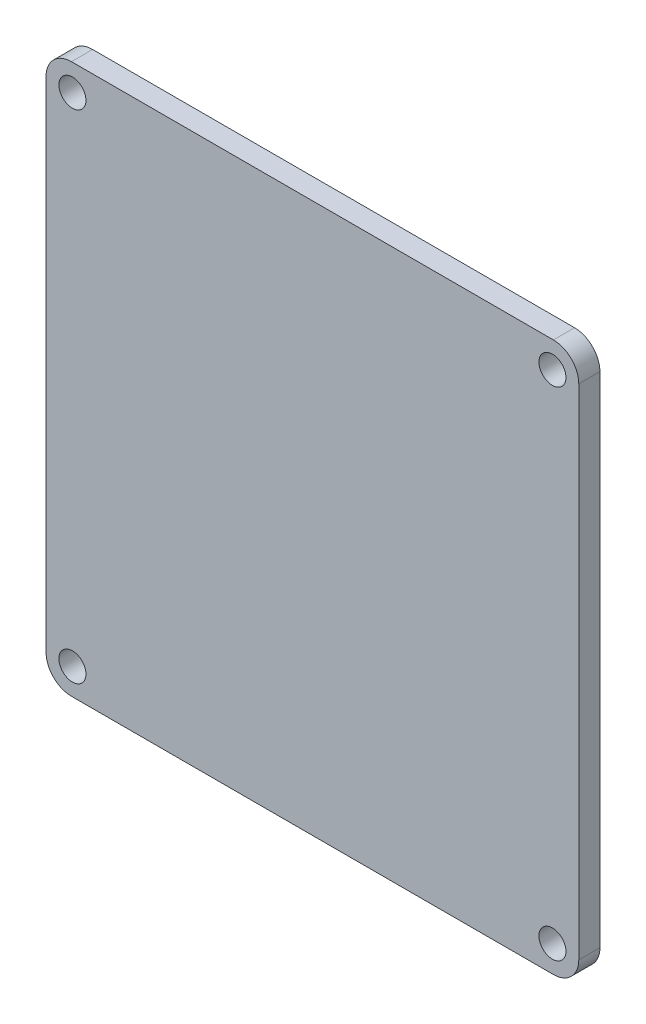
from build123d import *

# Parameters (mm, degrees)
SKETCH1_W           = 63
SKETCH1_H           = 65
BOSS_EXTRUDE3_DEPTH = 2.5
FILLET1_R           = 3
SKETCH2_R           = 1.6
CUT_EXTRUDE13_DEPTH = 2.5


with BuildPart() as part:
    # Sketch1 → Boss-Extrude3 (new body)
    with BuildSketch(Plane.XY):
        with Locations((31.5, 32.5)):
            Rectangle(SKETCH1_W, SKETCH1_H)
    extrude(amount=BOSS_EXTRUDE3_DEPTH)

    # Fillet1
    fillet1_edges = [part.edges().sort_by_distance(p)[0] for p in [
        (0, 0, 1.25),
        (0, 65, 1.25),
        (63, 65, 1.25),
        (63, 0, 1.25),
    ]]
    fillet(fillet1_edges, radius=FILLET1_R)

    # Sketch2 → Cut-Extrude13 (cut)
    with BuildSketch(Plane.XY):
        with Locations((3.115503651, 61.884496349)):
            Circle(SKETCH2_R)
        with Locations((3.115503651, 3.115503651)):
            Circle(SKETCH2_R)
        with Locations((59.884496349, 3.115503651)):
            Circle(SKETCH2_R)
        with Locations((59.884496349, 61.884496349)):
            Circle(SKETCH2_R)
    extrude(amount=CUT_EXTRUDE13_DEPTH, mode=Mode.SUBTRACT)


solid = part.part
